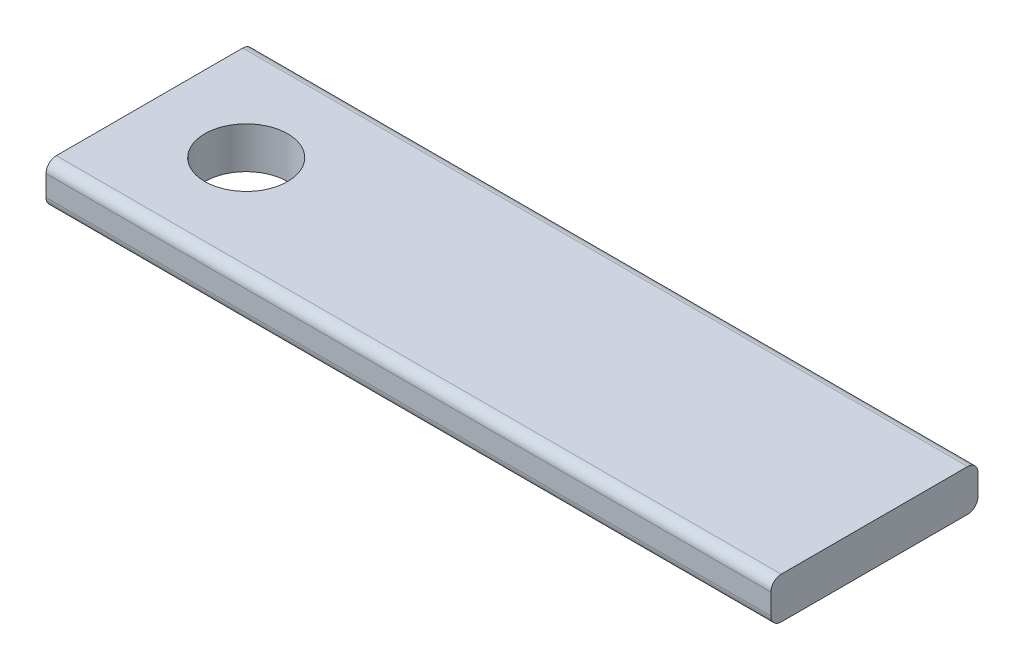
from build123d import *

# Parameters (mm, degrees)
SKETCH_1_W          = 52.5
SKETCH_1_H          = 15
EXTRUDE_1_DEPTH     = 1.5
FILLET_1_R          = 0.75
SKETCH_2_R          = 3
CUT_EXTRUDE_1_DEPTH = 3


with BuildPart() as part:
    # ｽｹｯﾁ1 → ﾎﾞｽ - 押し出し1 (new, symmetric)
    with BuildSketch(Plane(origin=(0, 0, 0), x_dir=(1, 0, 0), z_dir=(0, 1, 0))):
        Rectangle(SKETCH_1_W, SKETCH_1_H)
    extrude(amount=EXTRUDE_1_DEPTH, both=True)

    # ﾌｨﾚｯﾄ1
    fillet_1_edges = [part.edges().sort_by_distance(p)[0] for p in [
        (0, 1.5, 7.5),
        (0, -1.5, 7.5),
        (0, -1.5, -7.5),
        (0, 1.5, -7.5),
    ]]
    fillet(fillet_1_edges, radius=FILLET_1_R)

    # ｽｹｯﾁ2 → ｶｯﾄ - 押し出し1 (cut)
    with BuildSketch(Plane(origin=(0, 1.5, 0), x_dir=(1, 0, 0), z_dir=(0, 1, 0))):
        with Locations(Location((-19.25, 0, 0), (0, 0, 270))):
            Circle(SKETCH_2_R)
    extrude(amount=-CUT_EXTRUDE_1_DEPTH, mode=Mode.SUBTRACT)


solid = part.part
